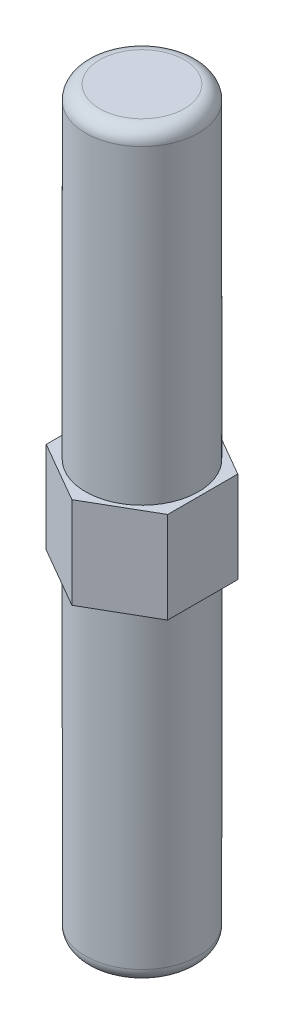
from build123d import *

# Parameters (mm, degrees)
BOSS_EXTRUDE1_DEPTH = 2.0574
SKETCH2_R           = 2.54
BOSS_EXTRUDE2_DEPTH = 14.605
FILLET1_R           = 0.635


with BuildPart() as part:
    # Sketch1 → Boss-Extrude1 (new, symmetric)
    with BuildSketch(Plane(origin=(0, 0, 0), x_dir=(1, 0, 0), z_dir=(0, 1, 0))):
        Polygon((-2.7305, -1.57645491), (0, -3.15290982), (2.7305, -1.57645491), (2.7305, 1.57645491), (0, 3.15290982), (-2.7305, 1.57645491), align=None)
    extrude(amount=BOSS_EXTRUDE1_DEPTH, both=True)

    # Sketch2 → Boss-Extrude2 (add)
    with BuildSketch(Plane(origin=(0, 2.0574, 0), x_dir=(1, 0, 0), z_dir=(0, 1, 0))):
        with Locations(Location((0, 0, 0), (0, 0, 90))):
            Circle(SKETCH2_R)
    boss_extrude2 = extrude(amount=BOSS_EXTRUDE2_DEPTH)

    # Mirror1: Boss-Extrude2 across plane
    add(boss_extrude2.mirror(Plane.ZX))

    # Fillet1
    fillet1_edges = [part.edges().sort_by_distance(p)[0] for p in [
        (0, 16.6624, 2.54),
        (0, -16.6624, 2.54),
    ]]
    fillet(fillet1_edges, radius=FILLET1_R)


solid = part.part
